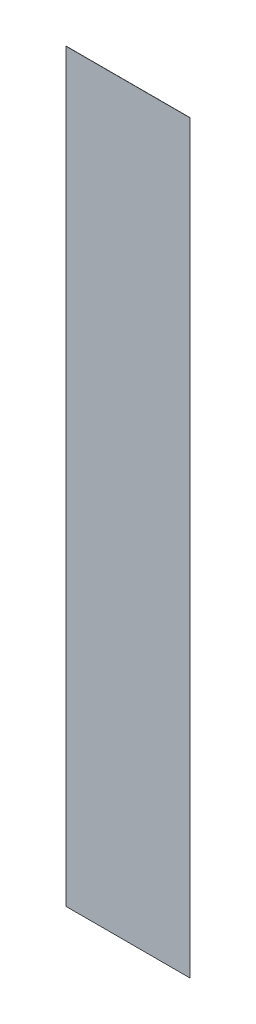
from build123d import *

# Parameters (mm, degrees)
SKETCH_1_W      = 6000
SKETCH_1_H      = 36000
EXTRUDE_1_DEPTH = 10


with BuildPart() as part:
    # 草图1 → 拉伸1 (new body)
    with BuildSketch(Plane.XY):
        with Locations((2960.587430168, -17968.587011173)):
            Rectangle(SKETCH_1_W, SKETCH_1_H)
    extrude(amount=EXTRUDE_1_DEPTH)


solid = part.part
